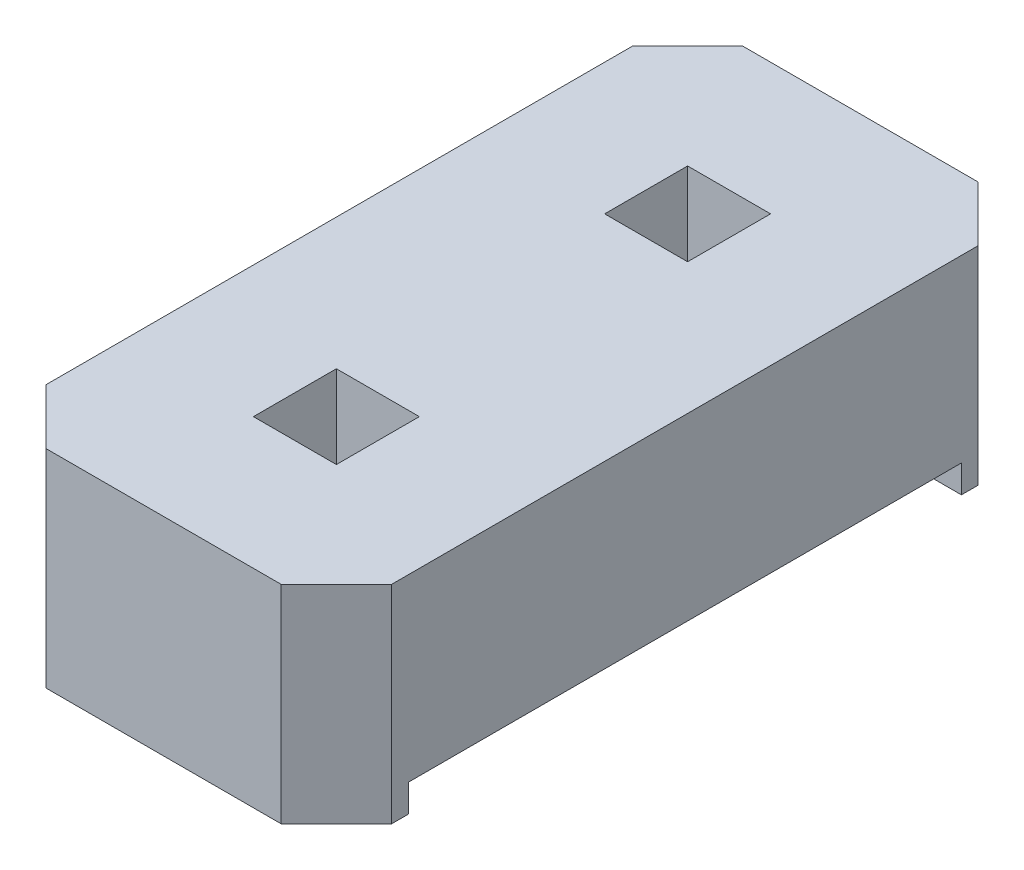
from build123d import *

# Parameters (mm, degrees)
ESQUISSE1_W             = 0.6
ESQUISSE1_H             = 0.6
BOSS_EXTRU_1_DEPTH      = 1.5
ESQUISSE2_W             = 4
ESQUISSE2_H             = 0.4
ENL_V_MAT_EXTRU_1_DEPTH = 4.853621673


with BuildPart() as part:
    # Esquisse1 → Boss.-Extru.1 (new body)
    with BuildSketch(Plane(origin=(0, 0, 0), x_dir=(1, 0, 0), z_dir=(0, 1, 0))):
        Polygon((-1.25, 2.12), (-0.85, 2.52), (0.85, 2.52), (1.25, 2.12), (1.25, -2.12), (0.85, -2.52), (-0.85, -2.52), (-1.25, -2.12), align=None)
        with Locations((0, -1.27)):
            Rectangle(ESQUISSE1_W, ESQUISSE1_H, mode=Mode.SUBTRACT)
        with Locations((0, 1.27)):
            Rectangle(ESQUISSE1_W, ESQUISSE1_H, mode=Mode.SUBTRACT)
    extrude(amount=BOSS_EXTRU_1_DEPTH)

    # Esquisse2 → Enlèv. mat.-Extru.1 (cut, through all)
    with BuildSketch(Plane.ZY.offset(1.25)):
        Rectangle(ESQUISSE2_W, ESQUISSE2_H)
    extrude(amount=-ENL_V_MAT_EXTRU_1_DEPTH, mode=Mode.SUBTRACT)


solid = part.part
